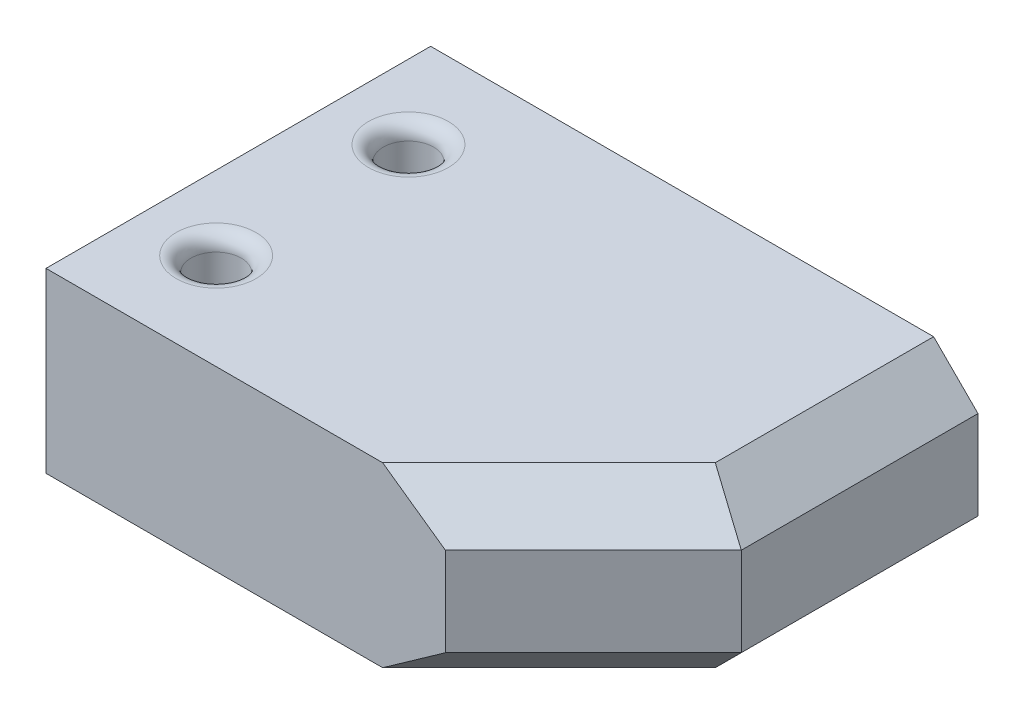
from build123d import *

# Parameters (mm, degrees)
SKETCH1_W               = 18.5
SKETCH1_H               = 13
BOSS_EXTRUDE1_DEPTH     = 6
CUT_EXTRUDE1_DEPTH      = 21.506096654
CUT_EXTRUDE1_DEPTH_BACK = 21.506096654
SKETCH2_R               = 0.85
FILLET1_R               = 0.5
CHAMFER1_SIZE           = 5
CHAMFER2_SIZE           = 1.5


with BuildPart() as part:
    # Sketch1 → Boss-Extrude1 (new body)
    with BuildSketch(Plane(origin=(0, 0, 0), x_dir=(1, 0, 0), z_dir=(0, 1, 0))):
        with Locations((9.25, 0)):
            Rectangle(SKETCH1_W, SKETCH1_H)
    extrude(amount=BOSS_EXTRUDE1_DEPTH)

    # Sketch2 → Cut-Extrude1 (cut, two sides: drawn at the far end of the back side and taken through both)
    with BuildSketch(Plane(origin=(0, 6, 0), x_dir=(1, 0, 0), z_dir=(0, 1, 0)).offset(-CUT_EXTRUDE1_DEPTH_BACK)):
        with Locations(Location((2.5, 3.25, 0), (0, 0, 270))):
            Circle(SKETCH2_R)
        with Locations(Location((2.5, -3.25, 0), (0, 0, 270))):
            Circle(SKETCH2_R)
    extrude(amount=CUT_EXTRUDE1_DEPTH + CUT_EXTRUDE1_DEPTH_BACK, mode=Mode.SUBTRACT)

    # Fillet1
    fillet1_edges = [part.edges().sort_by_distance(p)[0] for p in [
        (2.5, 0, -4.1),
        (2.5, 6, -4.1),
        (2.5, 0, 2.4),
        (2.5, 6, 2.4),
    ]]
    fillet(fillet1_edges, radius=FILLET1_R)

    # Chamfer1
    chamfer1_edges = [part.edges().sort_by_distance(p)[0] for p in [
        (18.5, 3, 6.5),
    ]]
    chamfer(chamfer1_edges, length=CHAMFER1_SIZE)

    # Chamfer2
    chamfer2_edges = [part.edges().sort_by_distance(p)[0] for p in [
        (18.5, 0, -2.5),
        (18.5, 6, -2.5),
        (16, 0, 4),
        (16, 6, 4),
    ]]
    chamfer(chamfer2_edges, length=CHAMFER2_SIZE)


solid = part.part
